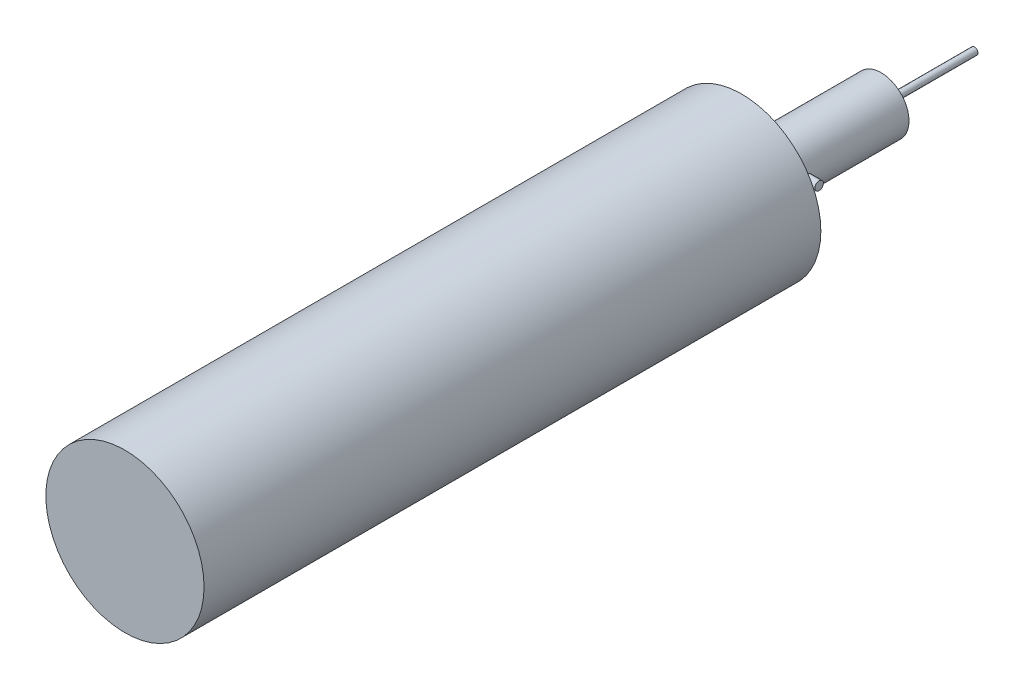
from build123d import *
from build123d.topology import SkipClean

# Parameters (mm, degrees)
ESQUISSE1_R             = 11.35
BOSS_EXTRU_1_DEPTH      = 88.5
ESQUISSE2_R             = 4
BOSS_EXTRU_2_DEPTH      = 20
ESQUISSE4_W             = 0.590657656
ESQUISSE4_H             = 10.980800687
BOSS_EXTRU_3_DEPTH      = 20
ESQUISSE5_R             = 0.615112373
BOSS_EXTRU_4_DEPTH      = 5.6
ENL_V_START             = -20
ENL_V_MAT_EXTRU_2_DEPTH = 20
ENL_V_MAT_EXTRU_3_DEPTH = 20
SKETCH1_R               = 0.5
BOSS_EXTRUDE1_DEPTH     = 13.4


with BuildPart() as part:
    # Esquisse1 → Boss.-Extru.1 (new body)
    with BuildSketch(Plane.XY):
        Circle(ESQUISSE1_R)
    extrude(amount=BOSS_EXTRU_1_DEPTH)

    # Esquisse2 → Boss.-Extru.2 (add)
    with BuildSketch(Plane(origin=(0, 0, 0), x_dir=(-1, 0, 0), z_dir=(0, 0, -1))):
        Circle(ESQUISSE2_R)
    extrude(amount=BOSS_EXTRU_2_DEPTH)

    # Esquisse4 → Boss.-Extru.3 (add)
    with BuildSketch(Plane(origin=(0, 0, 0), x_dir=(-1, 0, 0), z_dir=(0, 0, -1))):
        with Locations((0.295328828, 1.490400344)):
            Rectangle(ESQUISSE4_W, ESQUISSE4_H)
    extrude(amount=BOSS_EXTRU_3_DEPTH)

    # Esquisse5 → Boss.-Extru.4 (add)
    with BuildSketch(Plane(origin=(0, 0, 0), x_dir=(0, 0, -1), z_dir=(1, 0, 0))):
        with Locations((5.5, 0)):
            Circle(ESQUISSE5_R)
    extrude(amount=BOSS_EXTRU_4_DEPTH)

    # Esquisse7 → Enlèv. mat.-Extru.2 (cut)
    with BuildSketch(Plane(origin=(0, 0, -20), x_dir=(-1, 0, 0), z_dir=(0, 0, -1)).offset(ENL_V_START)):
        with BuildLine():
            Line((0.590657656, 6.980800687), (0, 6.980800687))
            Line((0, 6.980800687), (0, 4))
            ThreePointArc((0, 4), (0.296141555, 3.989022459), (0.590657656, 3.95615009))
            Line((0.590657656, 3.95615009), (0.590657656, 6.980800687))
        make_face()
    extrude(amount=ENL_V_MAT_EXTRU_2_DEPTH, mode=Mode.SUBTRACT)

    # Esquisse8 → Enlèv. mat.-Extru.3 (cut)
    with SkipClean():  # the faces are left unmerged after this step: merging them gives an invalid solid
        with BuildSketch(Plane(origin=(0, 0, -20), x_dir=(-1, 0, 0), z_dir=(0, 0, -1)).offset(ENL_V_START)):
            with BuildLine():
                ThreePointArc((0.590657656, -3.95615009), (0.296141555, -3.989022459), (0, -4))
                Line((0, -4), (0.590657656, -4))
                Line((0.590657656, -4), (0.590657656, -3.95615009))
            make_face()
        extrude(amount=ENL_V_MAT_EXTRU_3_DEPTH, mode=Mode.SUBTRACT)

    # Sketch1 → Boss-Extrude1 (add)
    with SkipClean():  # the faces are left unmerged after this step: merging them gives an invalid solid
        with BuildSketch(Plane(origin=(0, 0, -20), x_dir=(-1, 0, 0), z_dir=(0, 0, -1))):
            Circle(SKETCH1_R)
        extrude(amount=BOSS_EXTRUDE1_DEPTH)


solid = part.part
